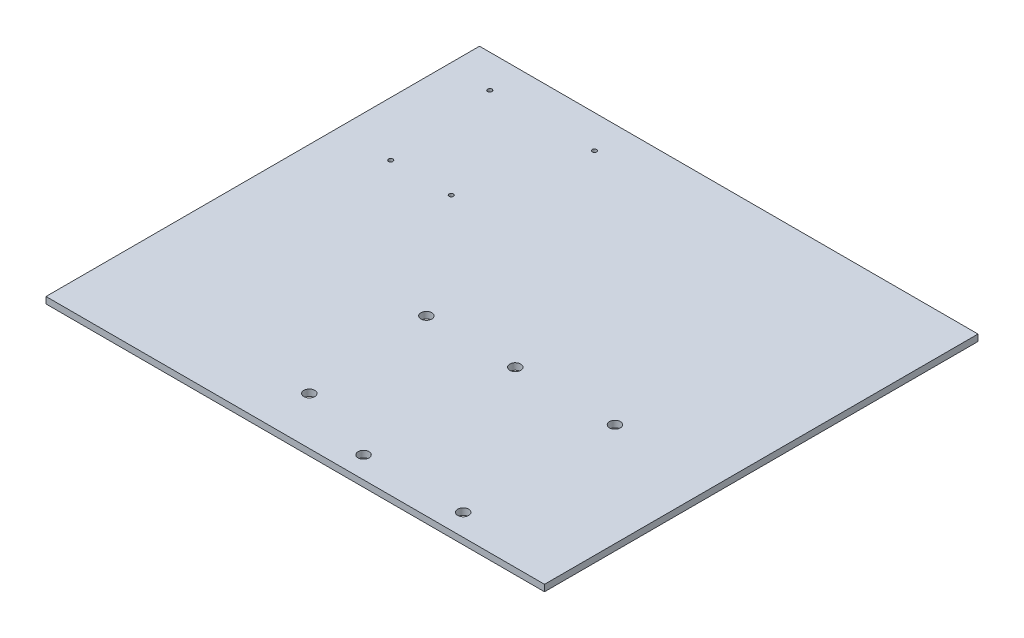
from build123d import *

# Parameters (mm, degrees)
SKETCH1_W           = 230
SKETCH1_H           = 200
SKETCH1_R           = 2.525
SKETCH1_R_2         = 1
BOSS_EXTRUDE2_DEPTH = 3


with BuildPart() as part:
    # Sketch1 → Boss-Extrude2 (new body)
    with BuildSketch(Plane(origin=(0, 0, 0), x_dir=(1, 0, 0), z_dir=(0, 1, 0))):
        with Locations((-115, 100)):
            Rectangle(SKETCH1_W, SKETCH1_H)
        with Locations(Location((-130.5, 22, 0), (0, 0, 270))):
            Circle(SKETCH1_R, mode=Mode.SUBTRACT)
        with Locations(Location((-93.5, 80, 0), (0, 0, 270))):
            Circle(SKETCH1_R, mode=Mode.SUBTRACT)
        with Locations(Location((-134.5, 80, 0), (0, 0, 270))):
            Circle(SKETCH1_R, mode=Mode.SUBTRACT)
        with Locations(Location((-47.5, 80, 0), (0, 0, 270))):
            Circle(SKETCH1_R, mode=Mode.SUBTRACT)
        with Locations(Location((-47.5, 10, 0), (0, 0, 270))):
            Circle(SKETCH1_R, mode=Mode.SUBTRACT)
        with Locations(Location((-93.5, 10, 0), (0, 0, 270))):
            Circle(SKETCH1_R, mode=Mode.SUBTRACT)
        with Locations(Location((-210, 184.76, 0), (0, 0, 270))):
            Circle(SKETCH1_R_2, mode=Mode.SUBTRACT)
        with Locations(Location((-161.74, 184.76, 0), (0, 0, 270))):
            Circle(SKETCH1_R_2, mode=Mode.SUBTRACT)
        with Locations(Location((-176.98, 133.96, 0), (0, 0, 270))):
            Circle(SKETCH1_R_2, mode=Mode.SUBTRACT)
        with Locations(Location((-204.92, 133.96, 0), (0, 0, 270))):
            Circle(SKETCH1_R_2, mode=Mode.SUBTRACT)
    extrude(amount=BOSS_EXTRUDE2_DEPTH)


solid = part.part
